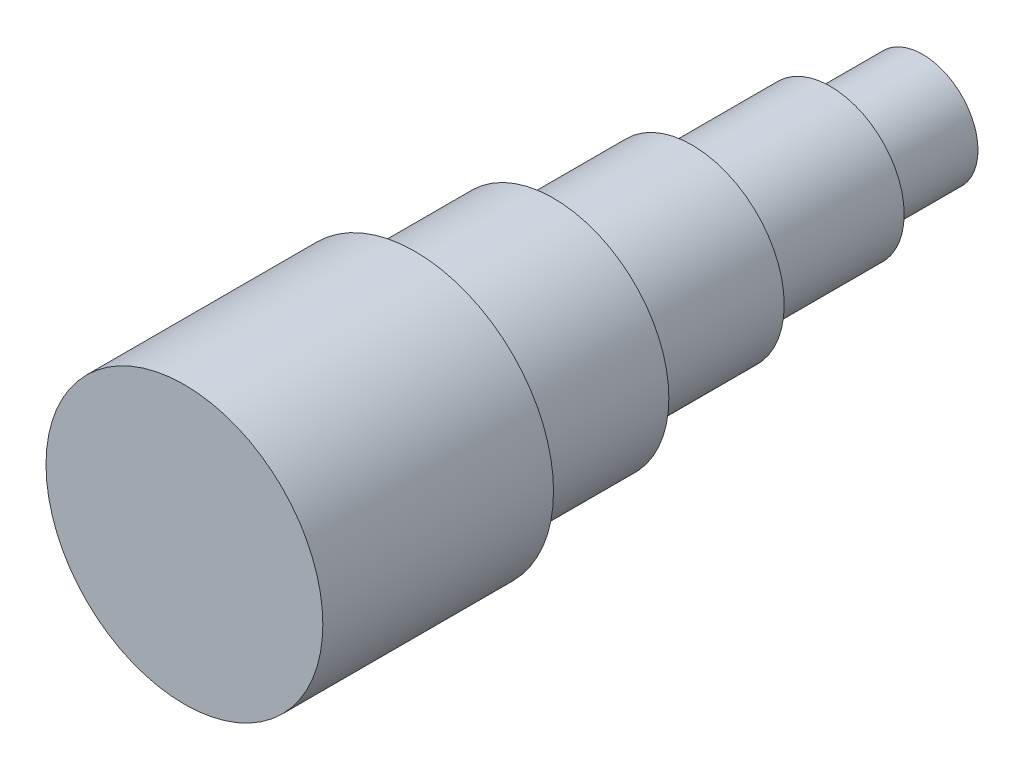
from build123d import *


with BuildPart() as part:
    # Sketch2 → VERSION3 (revolve)
    with BuildSketch(Plane(origin=(0, 0, 0), x_dir=(0, 0, -1), z_dir=(1, 0, 0)), mode=Mode.PRIVATE) as version3_sk:
        Polygon((0, 15), (0, 0), (2.5, 0), (2.5, 6), (2.5, 8), (2.5, 10), (2.5, 12.5), (25, 12.5), (25, 15), align=None)
        Polygon((40, 12.5), (25, 12.5), (2.5, 12.5), (2.5, 10), (40, 10), align=None)
        Polygon((2.5, 10), (2.5, 8), (55, 8), (55, 10), (40, 10), align=None)
        Polygon((2.5, 8), (2.5, 6), (70, 6), (70, 8), (55, 8), align=None)
        Polygon((2.5, 6), (2.5, 0), (80, 0), (80, 6), (71, 6), (70, 6), align=None)
    revolve(version3_sk.sketch.rotate(Axis((0, 0, 1328.276686543), (0, 0, -1)), 90), axis=Axis((0, 0, 1328.276686543), (0, 0, -1)))


solid = part.part
